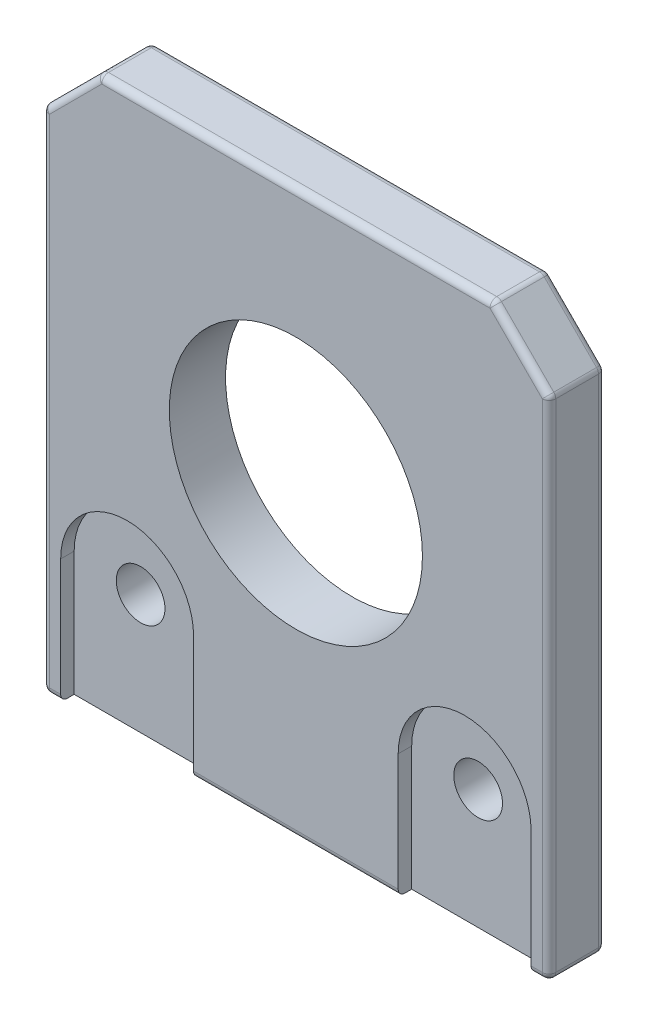
from build123d import *

# Parameters (mm, degrees)
SKETCH2_W            = 57.15
SKETCH2_H            = 6.35
BOSS_EXTRUDE1_DEPTH  = 63.5
SKETCH3_R            = 14.2875
CUT_EXTRUDE1_DEPTH   = 70.922121857
CHAMFER1_SIZE        = 6.35
M5_CLEARANCE_HOLE1_D = 5.5
FILLET1_R            = 0.762
CUT_EXTRUDE4_DEPTH   = 1.524


with BuildPart() as part:
    # Sketch2 → Boss-Extrude1 (new body)
    with BuildSketch(Plane(origin=(0, 0, 0), x_dir=(1, 0, 0), z_dir=(0, 1, 0))):
        Rectangle(SKETCH2_W, SKETCH2_H)
    extrude(amount=-BOSS_EXTRUDE1_DEPTH)

    # Sketch3 → Cut-Extrude1 (cut, through all)
    with BuildSketch(Plane.XY.offset(3.175)):
        with Locations((0, -28.8150046)):
            Circle(SKETCH3_R)
    extrude(amount=-CUT_EXTRUDE1_DEPTH, mode=Mode.SUBTRACT)

    # Chamfer1
    chamfer1_edges = [part.edges().sort_by_distance(p)[0] for p in [
        (28.575, 0, 0),
        (-28.575, 0, 0),
    ]]
    chamfer(chamfer1_edges, length=CHAMFER1_SIZE)

    # M5 Clearance Hole1 (through all)
    with Locations(Plane.XY.offset(3.175)):
        with Locations((-19.05, -50.000003124), (19.05, -50.000003124)):
            Hole(M5_CLEARANCE_HOLE1_D / 2)

    # Fillet1
    fillet1_edges = [part.edges().sort_by_distance(p)[0] for p in [
        (28.575, -63.5, 0),
        (0, -63.5, -3.175),
        (0, 0, 3.175),
        (0, 0, -3.175),
        (22.225, 0, 0),
        (-22.225, 0, 0),
        (25.4, -3.175, 3.175),
        (-25.4, -3.175, 3.175),
        (-28.575, -6.35, 0),
        (25.4, -3.175, -3.175),
        (-25.4, -3.175, -3.175),
        (28.575, -6.35, 0),
        (-28.575, -63.5, 0),
        (-28.575, -34.925, -3.175),
        (28.575, -34.925, -3.175),
        (28.575, -34.925, 3.175),
        (-28.575, -34.925, 3.175),
        (0, -63.5, 3.175),
    ]]
    fillet(fillet1_edges, radius=FILLET1_R)

    # Sketch8 → Cut-Extrude4 (cut)
    with BuildSketch(Plane.XY.offset(3.175)):
        with BuildLine():
            Line((11.55, -63.5), (11.55, -49.5))
            ThreePointArc((11.55, -49.5), (19.05, -42), (26.55, -49.5))
            Line((26.55, -49.5), (26.55, -63.5))
            Line((26.55, -63.5), (11.55, -63.5))
        make_face()
    cut_extrude4 = extrude(amount=-CUT_EXTRUDE4_DEPTH, mode=Mode.SUBTRACT)

    # Mirror1: Cut-Extrude4 across plane
    add(cut_extrude4.mirror(Plane(origin=(0, 0, 0), x_dir=(0, 0, 1), z_dir=(1, 0, 0))), mode=Mode.SUBTRACT)


solid = part.part
